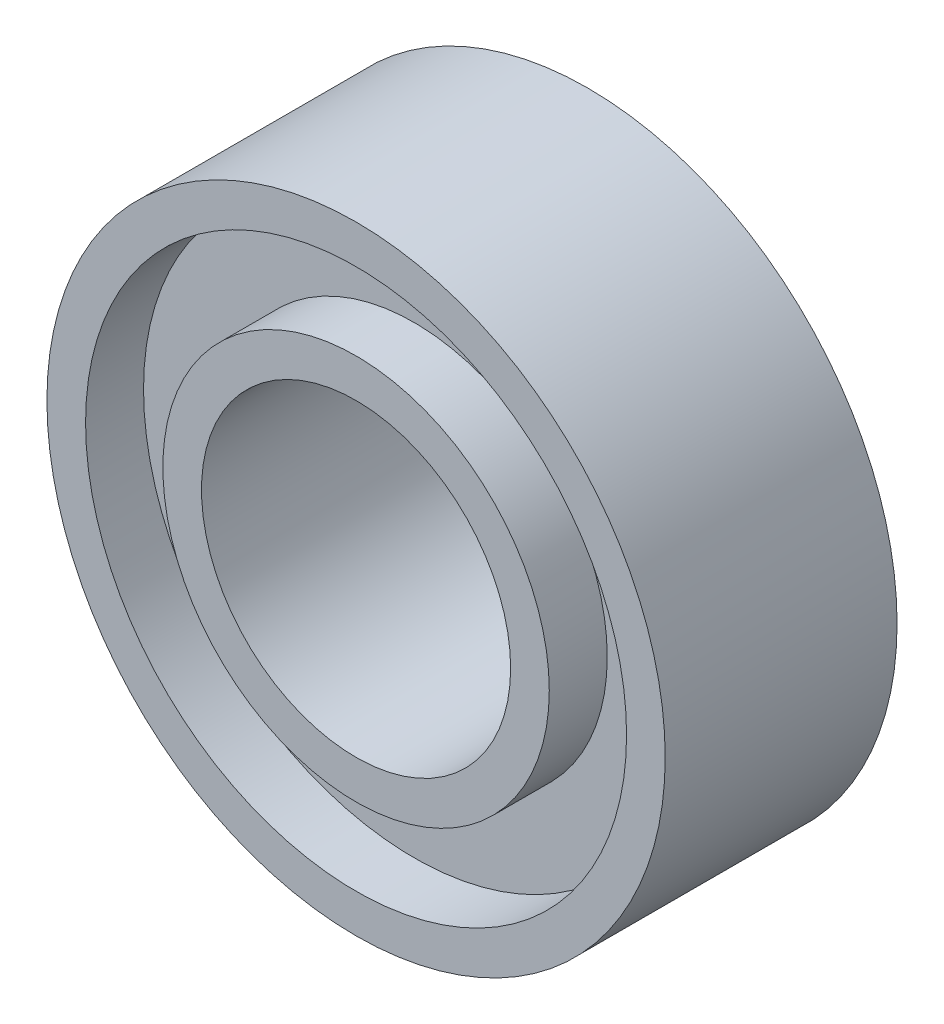
from build123d import *

# Parameters (mm, degrees)
SKETCH_1_R          = 8
SKETCH_1_R_2        = 4
EXTRUDE_1_DEPTH     = 6
SKETCH_2_R          = 7
SKETCH_2_R_2        = 5
CUT_EXTRUDE_1_DEPTH = 1.5


with BuildPart() as part:
    # 草图1 → 凸台-拉伸1 (new body)
    with BuildSketch(Plane.XY):
        Circle(SKETCH_1_R)
        Circle(SKETCH_1_R_2, mode=Mode.SUBTRACT)
    extrude(amount=EXTRUDE_1_DEPTH)

    # 草图2 → 切除-拉伸1 (cut)
    with BuildSketch(Plane.XY.offset(6)):
        Circle(SKETCH_2_R)
        Circle(SKETCH_2_R_2, mode=Mode.SUBTRACT)
    cut_extrude_1 = extrude(amount=-CUT_EXTRUDE_1_DEPTH, mode=Mode.SUBTRACT)

    # 镜向1: 切除-拉伸1 across plane
    add(cut_extrude_1.mirror(Plane.XY.offset(3)), mode=Mode.SUBTRACT)


solid = part.part
